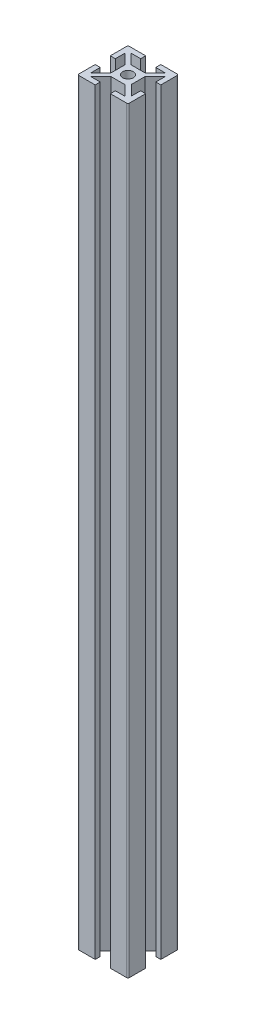
from build123d import *

# Parameters (mm, degrees)
SKETCH1_R           = 2.1
BOSS_EXTRUDE1_DEPTH = 300


with BuildPart() as part:
    # Sketch1 → Boss-Extrude1 (new body)
    with BuildSketch(Plane(origin=(0, 300, 0), x_dir=(1, 0, 0), z_dir=(0, 1, 0))):
        with BuildLine():
            Line((4, 2.746364236), (8, 6.746364236))
            Line((8, 6.746364236), (8, 3))
            Line((8, 3), (10, 3))
            Line((10, 3), (10, 9.5))
            ThreePointArc((10, 9.5), (9.853553391, 9.853553391), (9.5, 10))
            Line((9.5, 10), (3, 10))
            Line((3, 10), (3, 8))
            Line((3, 8), (6.863334179, 8))
            Line((6.863334179, 8), (2.863334179, 4))
            Line((2.863334179, 4), (-2.75, 4))
            Line((-2.75, 4), (-6.75, 8))
            Line((-6.75, 8), (-3, 8))
            Line((-3, 8), (-3, 10))
            Line((-3, 10), (-9.5, 10))
            ThreePointArc((-9.5, 10), (-9.853553391, 9.853553391), (-10, 9.5))
            Line((-10, 9.5), (-10, 3))
            Line((-10, 3), (-8, 3))
            Line((-8, 3), (-8, 6.75))
            Line((-8, 6.75), (-4, 2.75))
            Line((-4, 2.75), (-4, -2.75))
            Line((-4, -2.75), (-8, -6.75))
            Line((-8, -6.75), (-8, -3))
            Line((-8, -3), (-10, -3))
            Line((-10, -3), (-10, -9.5))
            ThreePointArc((-10, -9.5), (-9.853553391, -9.853553391), (-9.5, -10))
            Line((-9.5, -10), (-3, -10))
            Line((-3, -10), (-3, -8))
            Line((-3, -8), (-6.75, -8))
            Line((-6.75, -8), (-2.75, -4))
            Line((-2.75, -4), (2.868469119, -4))
            Line((2.868469119, -4), (6.868469119, -8))
            Line((6.868469119, -8), (3, -8))
            Line((3, -8), (3, -10))
            Line((3, -10), (9.5, -10))
            ThreePointArc((9.5, -10), (9.853553391, -9.853553391), (10, -9.5))
            Line((10, -9.5), (10, -3))
            Line((10, -3), (8, -3))
            Line((8, -3), (8, -6.665189266))
            Line((8, -6.665189266), (4, -2.665189266))
            Line((4, -2.665189266), (4, 2.746364236))
        make_face()
        with Locations(Location((0, 0, 0), (0, 0, 90))):
            Circle(SKETCH1_R, mode=Mode.SUBTRACT)
    extrude(amount=-BOSS_EXTRUDE1_DEPTH)


solid = part.part
